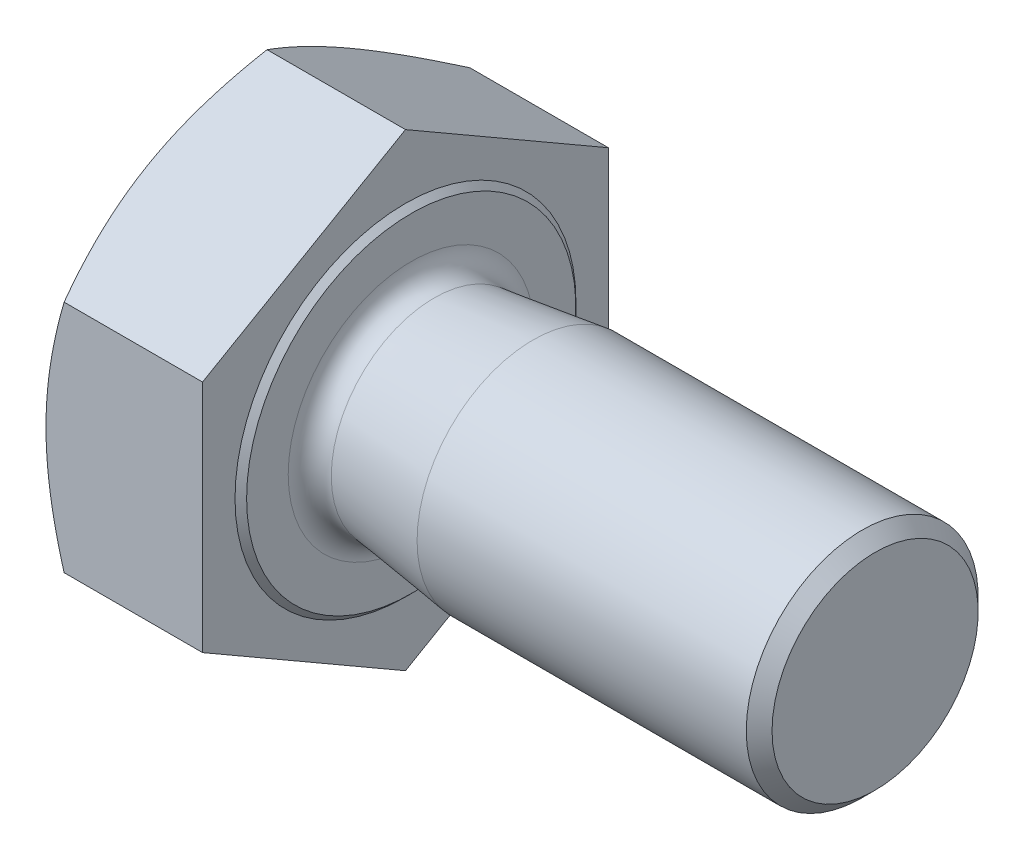
from build123d import *

# Parameters (mm, degrees)
EXTRUDE_1_DEPTH     = 2.8
SKETCH_4_R          = 7.66
SKETCH_4_R_2        = 3.5
CUT_EXTRUDE_1_DEPTH = 0.35
CUT_EXTRUDE_1_DRAFT = -60
CHAMFER_1_SIZE      = 0.222222222


with BuildPart() as part:
    # 草图3 → 凸台-拉伸1 (new body)
    with BuildSketch(Plane(origin=(0, 0, 0), x_dir=(0, 0, -1), z_dir=(1, 0, 0))):
        Polygon((3.5, 2.020725942), (0, 4.041451884), (-3.5, 2.020725942), (-3.5, -2.020725942), (0, -4.041451884), (3.5, -2.020725942), align=None)
    extrude(amount=EXTRUDE_1_DEPTH)


with BuildPart() as cut_extrude_1_tool:
    # 草图4 → 切除-拉伸1 (with draft: the straight prism first)
    with BuildSketch(Plane.ZY):
        Circle(SKETCH_4_R)
        Circle(SKETCH_4_R_2, mode=Mode.SUBTRACT)
    extrude(amount=-CUT_EXTRUDE_1_DEPTH)
    # 切除-拉伸1: the draft: its side faces are tilted about the plane it starts from
    cut_extrude_1_sides = [cut_extrude_1_tool.faces().sort_by_distance(p)[0] for p in [
        (0.175, 0, -7.66),
        (0.175, 0, -3.5),
    ]]
    draft(cut_extrude_1_sides, Plane.ZY, CUT_EXTRUDE_1_DRAFT)


with BuildPart() as part_1:
    add(part.part)

    # 切除-拉伸1: cut by cut_extrude_1_tool
    add(cut_extrude_1_tool.part, mode=Mode.SUBTRACT)

    # 草图6 → 旋转2 (revolve)
    with BuildSketch(Plane.XY, mode=Mode.PRIVATE) as revolve_2_sk:
        with BuildLine():
            Line((4.9, 2), (10.8, 2))
            Line((10.8, 2), (10.8, 0))
            Line((10.8, 0), (2.8, 0))
            Line((2.8, 0), (2.8, 2.122675))
            ThreePointArc((2.8, 2.122675), (2.919225418, 1.859534178), (3.195674814, 1.775668067))
            Line((3.195674814, 1.775668067), (4.9, 2))
        make_face()
    revolve(revolve_2_sk.sketch.rotate(Axis((2.8, 0, 0), (1, 0, 0)), 90), axis=Axis((2.8, 0, 0), (1, 0, 0)))

    # 倒角1
    chamfer_1_edges = [part_1.edges().sort_by_distance(p)[0] for p in [
        (10.8, 0, -2),
    ]]
    chamfer(chamfer_1_edges, length=CHAMFER_1_SIZE)

    # 草图8 → 切除-旋转2 (revolve, cut)
    with BuildSketch(Plane.XY, mode=Mode.PRIVATE) as cut_revolve_2_sk:
        Polygon((2.8, 2.84), (2.7, 2.94), (2.7, 7.66), (2.8, 7.66), align=None)
    revolve(cut_revolve_2_sk.sketch.rotate(Axis((0, 0, 0), (1, 0, 0)), 90), axis=Axis((0, 0, 0), (1, 0, 0)), mode=Mode.SUBTRACT)


solid = part_1.part
